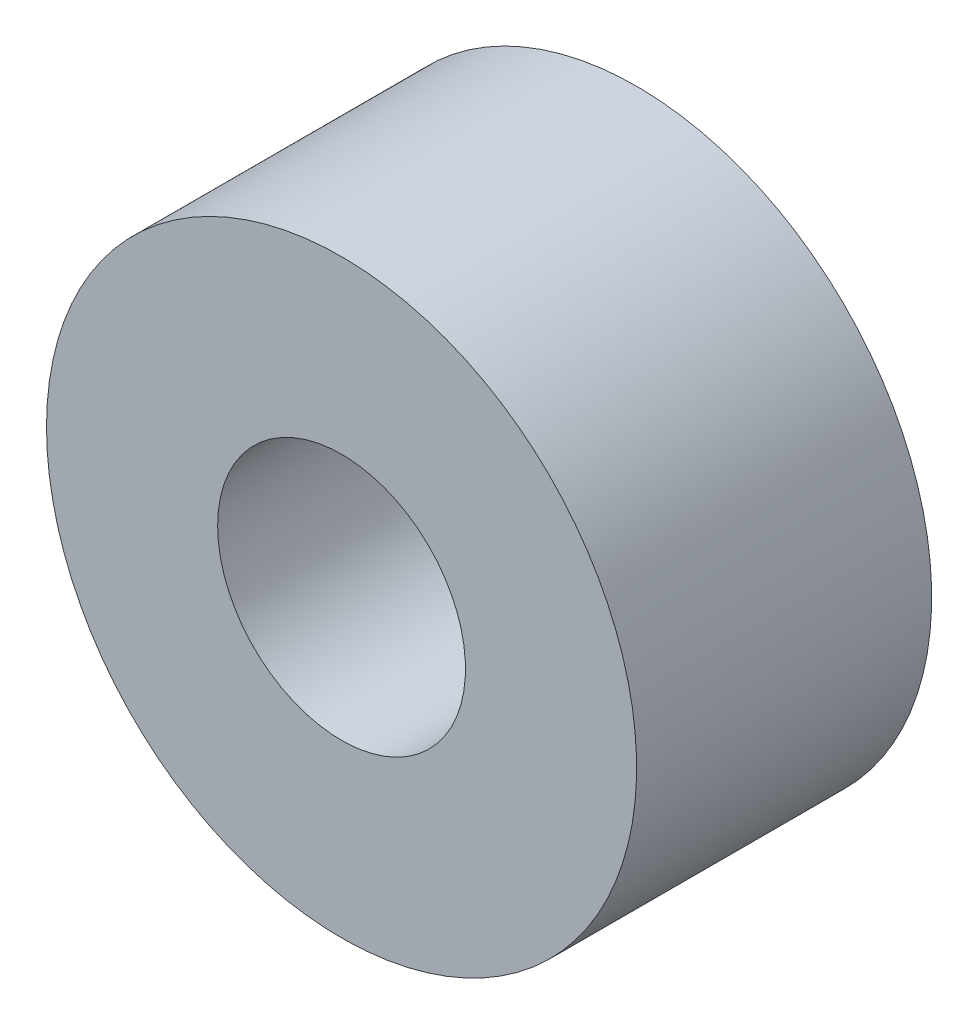
from build123d import *

# Parameters (mm, degrees)
SKETCH1_R      = 9.525
SKETCH1_R_2    = 4.0005
EXTRUDE1_DEPTH = 4.7625


with BuildPart() as part:
    # Sketch1 → Extrude1 (new, symmetric)
    with BuildSketch(Plane.XY):
        with Locations(Location((0, 0, 0), (0, 0, 180))):
            Circle(SKETCH1_R)
        with Locations(Location((0, 0, 0), (0, 0, 180))):
            Circle(SKETCH1_R_2, mode=Mode.SUBTRACT)
    extrude(amount=EXTRUDE1_DEPTH, both=True)


solid = part.part
